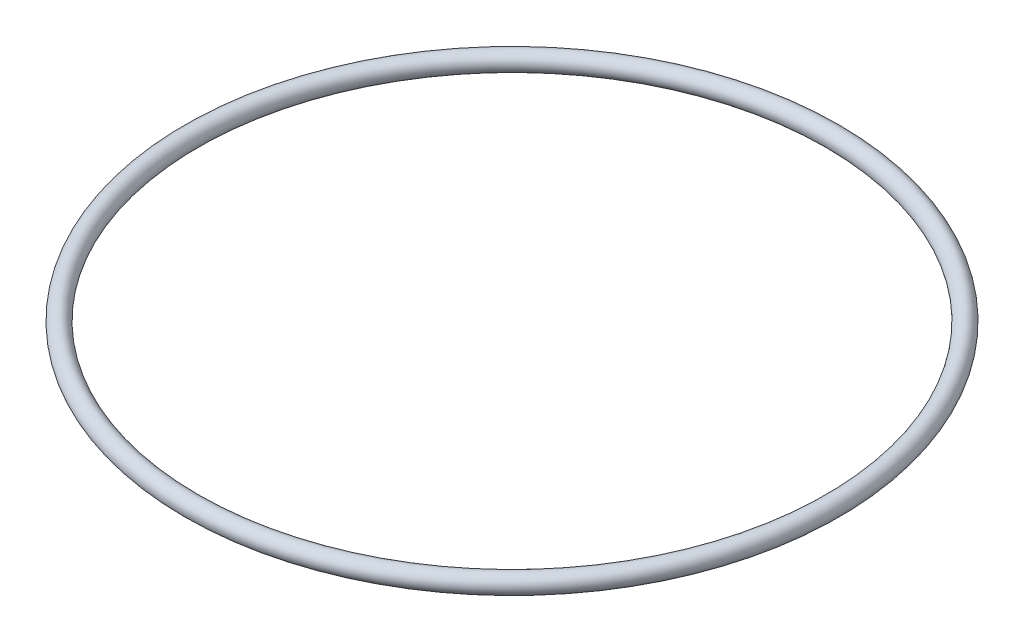
from build123d import *

# Parameters (mm, degrees)
SKETCH1_R = 1.25


with BuildPart() as part:
    # Sketch1 → Revolve1 (revolve)
    with BuildSketch(Plane.XY, mode=Mode.PRIVATE) as revolve1_sk:
        with Locations((-43.4, 0)):
            Circle(SKETCH1_R)
    revolve(revolve1_sk.sketch.rotate(Axis((0, 0, 0), (0, 1, 0)), 270), axis=Axis((0, 0, 0), (0, 1, 0)))


solid = part.part
